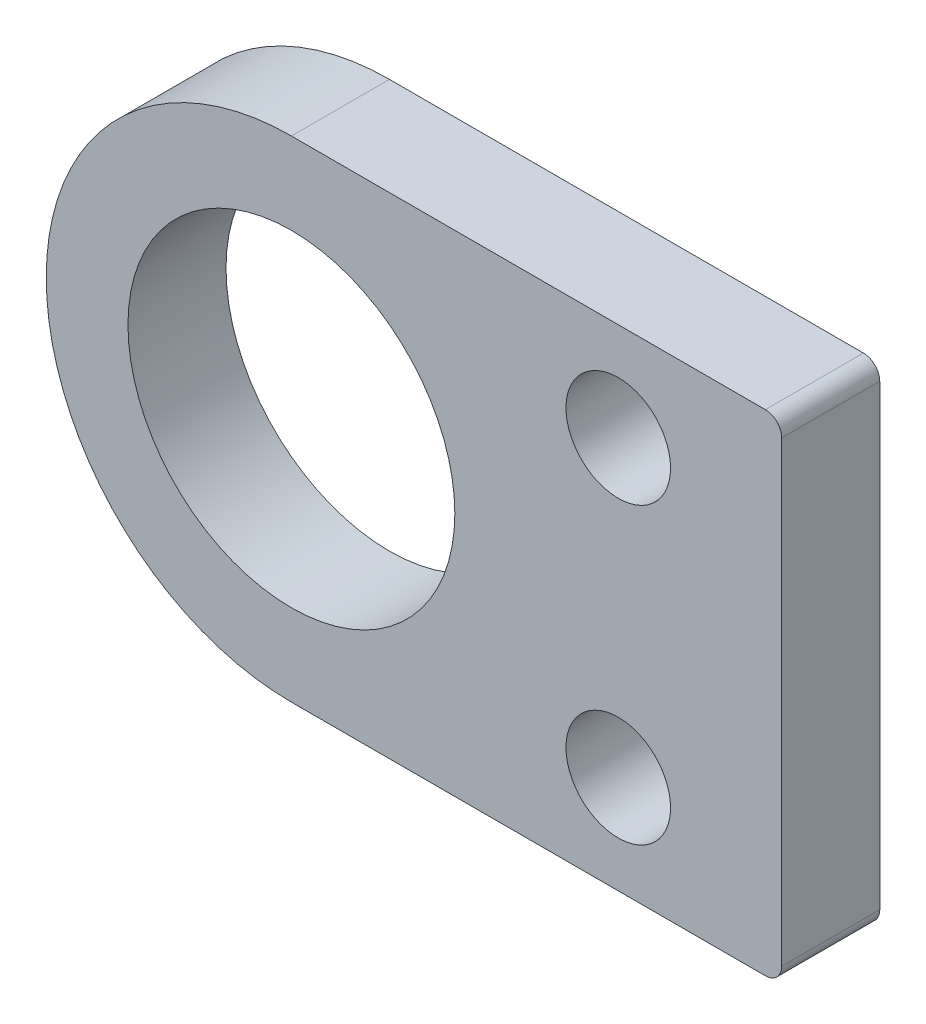
from build123d import *

# Parameters (mm, degrees)
SKETCH_1_R      = 5
SKETCH_1_R_2    = 1.6
EXTRUDE_1_DEPTH = 3
FILLET_1_R      = 0.5


with BuildPart() as part:
    # ｽｹｯﾁ1 → ﾎﾞｽ - 押し出し1 (new body)
    with BuildSketch(Plane.XY):
        with BuildLine():
            Line((0, 7.5), (15, 7.5))
            Line((15, 7.5), (15, -7.5))
            Line((15, -7.5), (0, -7.5))
            ThreePointArc((0, -7.5), (-7.5, 0), (0, 7.5))
        make_face()
        Circle(SKETCH_1_R, mode=Mode.SUBTRACT)
        with Locations((10, 4.5)):
            Circle(SKETCH_1_R_2, mode=Mode.SUBTRACT)
        with Locations(Location((10, -4.5, 0), (0, 0, 180))):
            Circle(SKETCH_1_R_2, mode=Mode.SUBTRACT)
    extrude(amount=EXTRUDE_1_DEPTH)

    # ﾌｨﾚｯﾄ1
    fillet_1_edges = [part.edges().sort_by_distance(p)[0] for p in [
        (15, 7.5, 1.5),
        (15, -7.5, 1.5),
    ]]
    fillet(fillet_1_edges, radius=FILLET_1_R)


solid = part.part
